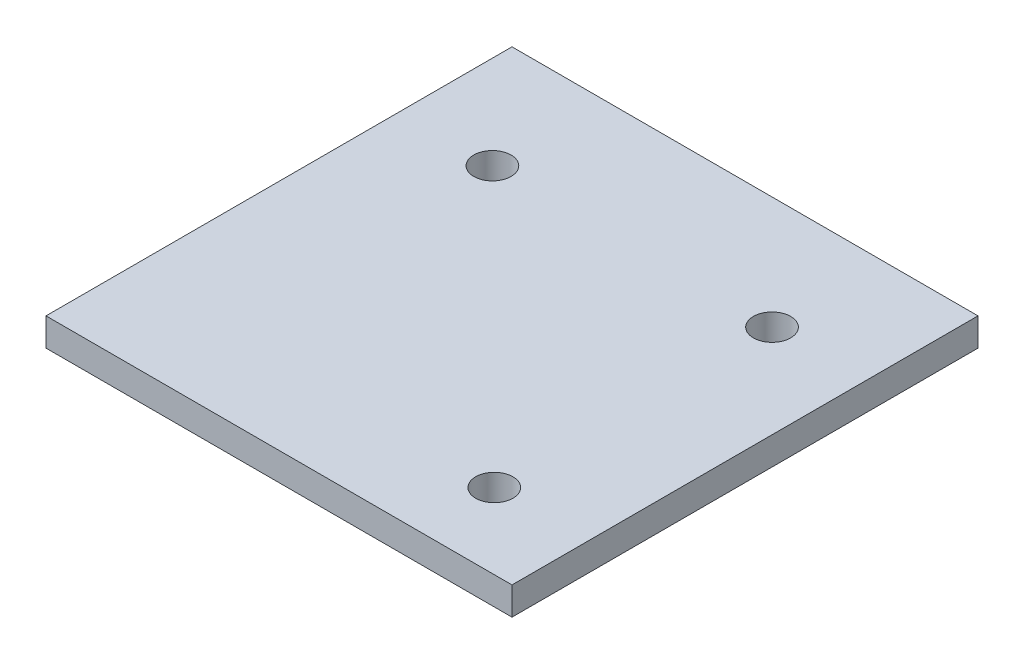
from build123d import *

# Parameters (mm, degrees)
SKETCH_1_W          = 50
SKETCH_1_H          = 50
EXTRUDE_1_DEPTH     = 3
CUT_EXTRUDE_1_REACH = 37.482
SKETCH_2_R          = 2
CUT_EXTRUDE_2_REACH = 37.482
SKETCH_3_R          = 2


with BuildPart() as part:
    # 草图1 → 凸台-拉伸1 (new body)
    with BuildSketch(Plane(origin=(0, 0, 0), x_dir=(1, 0, 0), z_dir=(0, 1, 0))):
        Rectangle(SKETCH_1_W, SKETCH_1_H)
    extrude(amount=EXTRUDE_1_DEPTH)

    # 草图2 → 切除-拉伸1 (cut, up to next)
    with BuildSketch(Plane(origin=(0, 3, 0), x_dir=(1, 0, 0), z_dir=(0, 1, 0)), mode=Mode.PRIVATE) as cut_extrude_1_sk1:
        with Locations(Location((-15, 12.9, 0), (0, 0, 270))):
            Circle(SKETCH_2_R)
    cut_extrude_1_tool1 = extrude(cut_extrude_1_sk1.sketch, amount=-CUT_EXTRUDE_1_REACH, mode=Mode.PRIVATE) & part.part
    # 草图2 → 切除-拉伸1 (cut, up to next)
    with BuildSketch(Plane(origin=(0, 3, 0), x_dir=(1, 0, 0), z_dir=(0, 1, 0)), mode=Mode.PRIVATE) as cut_extrude_1_sk2:
        with Locations(Location((15, 12.9, 0), (0, 0, 270))):
            Circle(SKETCH_2_R)
    cut_extrude_1_tool2 = extrude(cut_extrude_1_sk2.sketch, amount=-CUT_EXTRUDE_1_REACH, mode=Mode.PRIVATE) & part.part
    add(cut_extrude_1_tool1.solids().sort_by_distance((-15, 3, -12.9))[0], mode=Mode.SUBTRACT)
    add(cut_extrude_1_tool2.solids().sort_by_distance((15, 3, -12.9))[0], mode=Mode.SUBTRACT)

    # 草图3 → 切除-拉伸2 (cut, up to next)
    with BuildSketch(Plane(origin=(0, 3, 0), x_dir=(1, 0, 0), z_dir=(0, 1, 0)), mode=Mode.PRIVATE) as cut_extrude_2_sk1:
        with Locations(Location((15, -16.9, 0), (0, 0, 270))):
            Circle(SKETCH_3_R)
    cut_extrude_2_tool1 = extrude(cut_extrude_2_sk1.sketch, amount=-CUT_EXTRUDE_2_REACH, mode=Mode.PRIVATE) & part.part
    add(cut_extrude_2_tool1.solids().sort_by_distance((15, 3, 16.9))[0], mode=Mode.SUBTRACT)


solid = part.part
